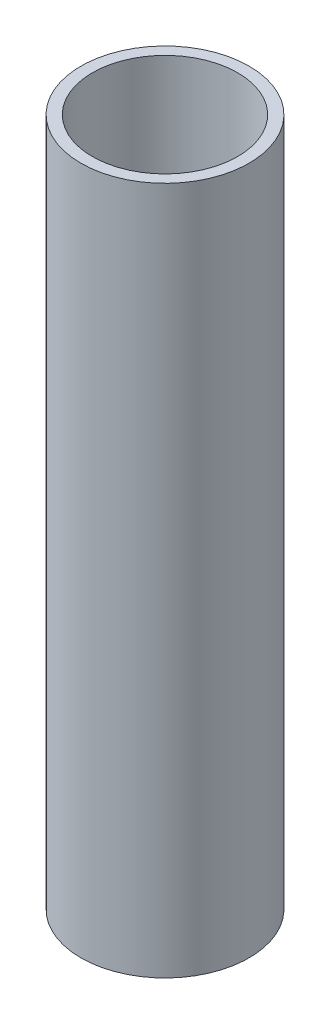
from build123d import *

# Parameters (mm, degrees)
SKETCH1_R           = 11
SKETCH1_R_2         = 9.5
BOSS_EXTRUDE1_DEPTH = 90


with BuildPart() as part:
    # Sketch1 → Boss-Extrude1 (new body)
    with BuildSketch(Plane(origin=(0, 0, 0), x_dir=(1, 0, 0), z_dir=(0, 1, 0))):
        with Locations(Location((0, 0, 0), (0, 0, 90))):
            Circle(SKETCH1_R)
        with Locations(Location((0, 0, 0), (0, 0, 90))):
            Circle(SKETCH1_R_2, mode=Mode.SUBTRACT)
    extrude(amount=BOSS_EXTRUDE1_DEPTH)


solid = part.part
